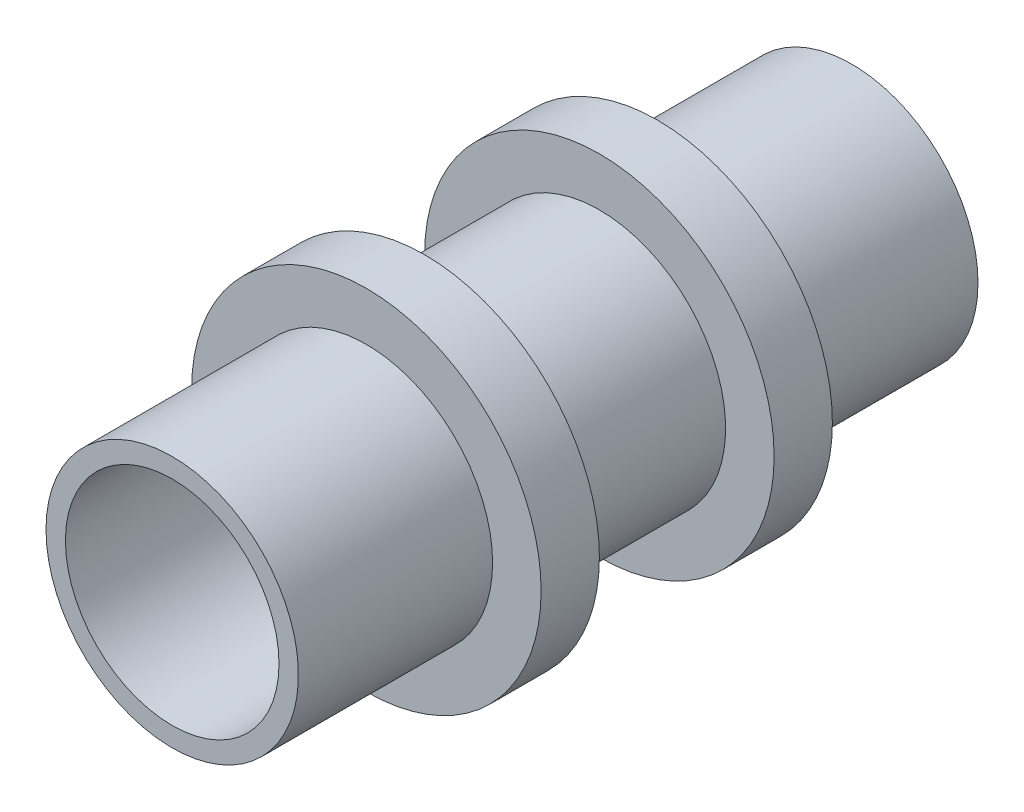
from build123d import *

# Parameters (mm, degrees)
SKETCH1_R           = 8.255
SKETCH1_R_2         = 6.985
BOSS_EXTRUDE1_DEPTH = 19.05
SKETCH2_R           = 11.43
SKETCH2_R_2         = 8.255
BOSS_EXTRUDE2_DEPTH = 3.81
BOSS_EXTRUDE3_START = 12.7
SKETCH3_R           = 8.255
SKETCH3_R_2         = 6.985
BOSS_EXTRUDE3_DEPTH = 12.7


with BuildPart() as part:
    # Sketch1 → Boss-Extrude1 (new body)
    with BuildSketch(Plane.XY):
        with Locations(Location((0, 0, 0), (0, 0, 180))):
            Circle(SKETCH1_R)
        with Locations(Location((0, 0, 0), (0, 0, 180))):
            Circle(SKETCH1_R_2, mode=Mode.SUBTRACT)
    extrude(amount=BOSS_EXTRUDE1_DEPTH)

    # Sketch2 → Boss-Extrude2 (add)
    with BuildSketch(Plane.XY):
        with Locations(Location((0, 0, 0), (0, 0, 180))):
            Circle(SKETCH2_R)
        with Locations(Location((0, 0, 0), (0, 0, 180))):
            Circle(SKETCH2_R_2, mode=Mode.SUBTRACT)
    boss_extrude2 = extrude(amount=BOSS_EXTRUDE2_DEPTH)

    # Sketch3 → Boss-Extrude3 (add)
    with BuildSketch(Plane(origin=(0, 0, 0), x_dir=(-1, 0, 0), z_dir=(0, 0, -1)).offset(BOSS_EXTRUDE3_START)):
        Circle(SKETCH3_R)
        Circle(SKETCH3_R_2, mode=Mode.SUBTRACT)
    boss_extrude3 = extrude(amount=-BOSS_EXTRUDE3_DEPTH)

    # Mirror1: Boss-Extrude2 across plane
    add(boss_extrude2.mirror(Plane(origin=(0, 0, 9.525), x_dir=(1, 0, 0), z_dir=(0, 0, -1))))

    # Mirror2: Boss-Extrude3 across plane
    add(boss_extrude3.mirror(Plane(origin=(0, 0, 9.525), x_dir=(1, 0, 0), z_dir=(0, 0, -1))))


solid = part.part
